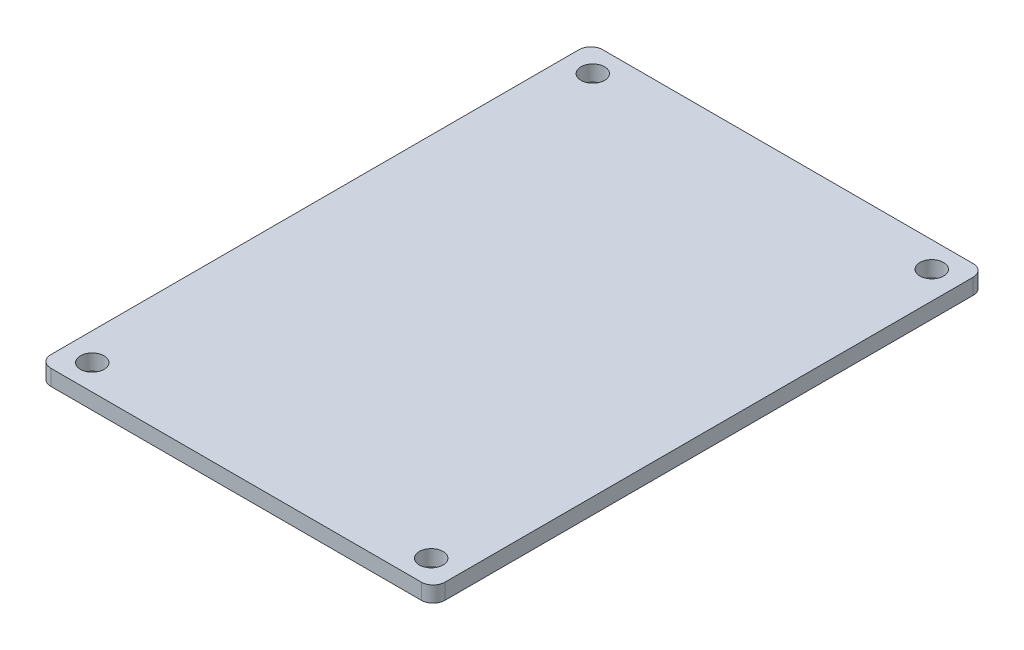
from build123d import *

# Parameters (mm, degrees)
SKETCH1_W           = 100
SKETCH1_H           = 140
BOSS_EXTRUDE1_DEPTH = 4
SKETCH2_R           = 3
CUT_EXTRUDE1_DEPTH  = 4
FILLET1_R           = 3


with BuildPart() as part:
    # Sketch1 → Boss-Extrude1 (new body)
    with BuildSketch(Plane(origin=(0, 0, 0), x_dir=(1, 0, 0), z_dir=(0, 1, 0))):
        with Locations((-17.210144928, 12.807971014)):
            Rectangle(SKETCH1_W, SKETCH1_H)
    extrude(amount=BOSS_EXTRUDE1_DEPTH)

    # Sketch2 → Cut-Extrude1 (cut)
    with BuildSketch(Plane(origin=(0, 4, 0), x_dir=(1, 0, 0), z_dir=(0, 1, 0))):
        with Locations(Location((25.789855072, -50.692028986, 0), (0, 0, 270))):
            Circle(SKETCH2_R)
        with Locations(Location((-60.210144928, -50.692028986, 0), (0, 0, 270))):
            Circle(SKETCH2_R)
        with Locations(Location((25.789855072, 76.307971014, 0), (0, 0, 270))):
            Circle(SKETCH2_R)
        with Locations(Location((-60.210144928, 76.307971014, 0), (0, 0, 270))):
            Circle(SKETCH2_R)
    extrude(amount=-CUT_EXTRUDE1_DEPTH, mode=Mode.SUBTRACT)

    # Fillet1
    fillet1_edges = [part.edges().sort_by_distance(p)[0] for p in [
        (-67.210144928, 2, -82.807971014),
        (32.789855072, 2, -82.807971014),
        (32.789855072, 2, 57.192028986),
        (-67.210144928, 2, 57.192028986),
    ]]
    fillet(fillet1_edges, radius=FILLET1_R)


solid = part.part
